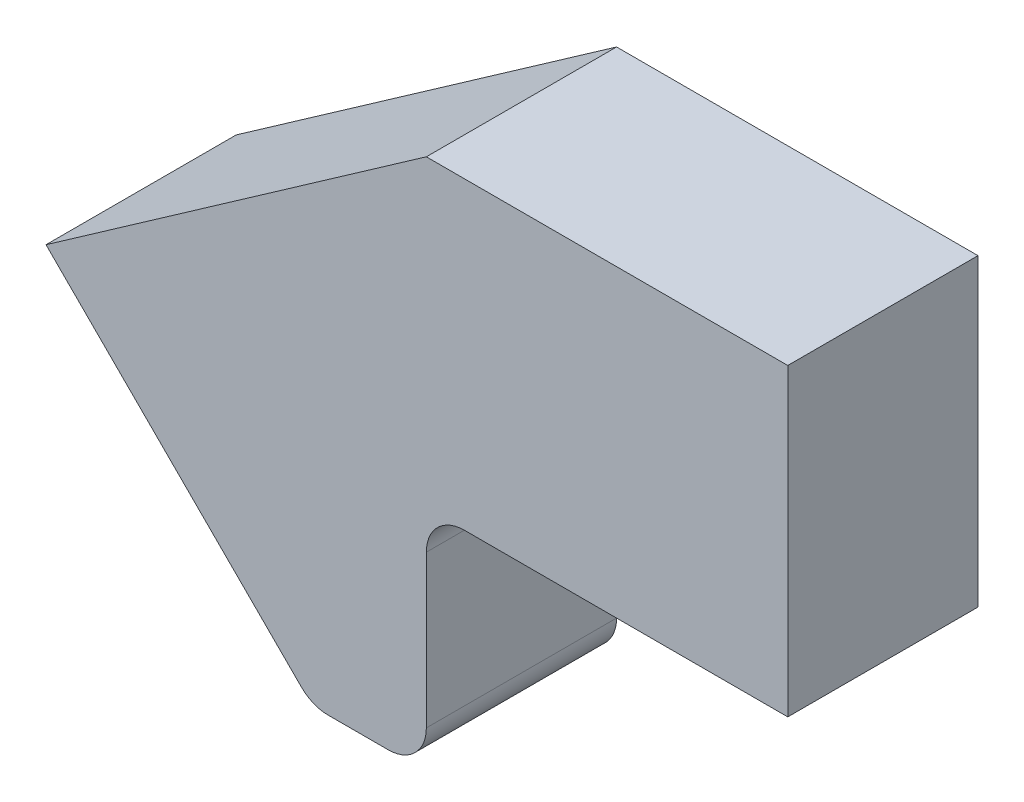
from build123d import *

# Parameters (mm, degrees)
BOSS_EXTRUDE1_DEPTH = 0.125
FILLET1_R           = 0.05


with BuildPart() as part:
    # frame_outline → Boss-Extrude1 (new, symmetric)
    with BuildSketch(Plane.XY):
        Polygon((0, 0), (0.499851802, 0.35), (0.974851802, 0.35), (0.974851802, -0.05), (0.499851802, -0.05), (0.499851802, -0.35), (0.35, -0.35), align=None)
    extrude(amount=BOSS_EXTRUDE1_DEPTH, both=True)

    # Fillet1
    fillet1_edges = [part.edges().sort_by_distance(p)[0] for p in [
        (0.499851802, -0.05, 0),
        (0.499851802, -0.35, 0),
        (0.35, -0.35, 0),
    ]]
    fillet(fillet1_edges, radius=FILLET1_R)


solid = part.part
